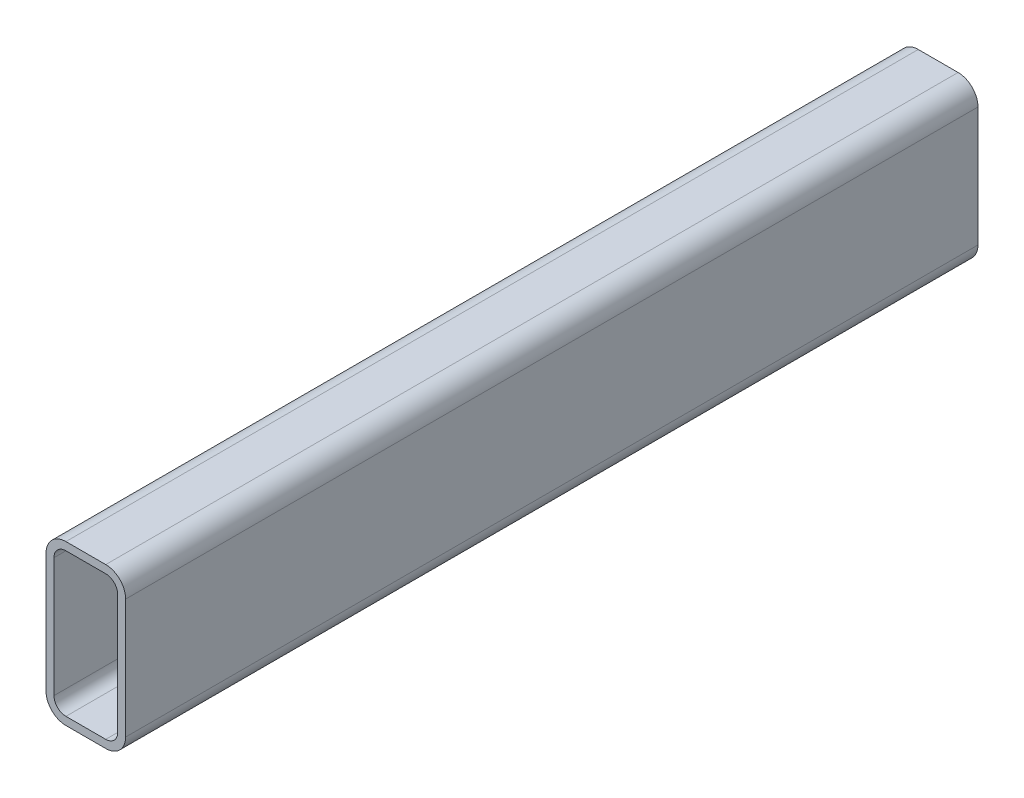
from build123d import *

# Parameters (mm, degrees)
EXTRUDE_1_DEPTH = 428


with BuildPart() as part:
    # Sketch 186 → 凸台-拉伸1 (new, symmetric)
    with BuildSketch(Plane.XY):
        with BuildLine():
            Line((-20, 80), (20, 80))
            ThreePointArc((20, 80), (34.142135624, 74.142135624), (40, 60))
            Line((40, 60), (40, -60))
            ThreePointArc((40, -60), (34.142135624, -74.142135624), (20, -80))
            Line((20, -80), (-20, -80))
            ThreePointArc((-20, -80), (-34.142135624, -74.142135624), (-40, -60))
            Line((-40, -60), (-40, 60))
            ThreePointArc((-40, 60), (-34.142135624, 74.142135624), (-20, 80))
        make_face()
        with BuildLine():
            Line((-20, 72), (20, 72))
            ThreePointArc((20, 72), (28.485281374, 68.485281374), (32, 60))
            Line((32, 60), (32, -60))
            ThreePointArc((32, -60), (28.485281374, -68.485281374), (20, -72))
            Line((20, -72), (-20, -72))
            ThreePointArc((-20, -72), (-28.485281374, -68.485281374), (-32, -60))
            Line((-32, -60), (-32, 60))
            ThreePointArc((-32, 60), (-28.485281374, 68.485281374), (-20, 72))
        make_face(mode=Mode.SUBTRACT)
    extrude(amount=EXTRUDE_1_DEPTH, both=True)


solid = part.part
